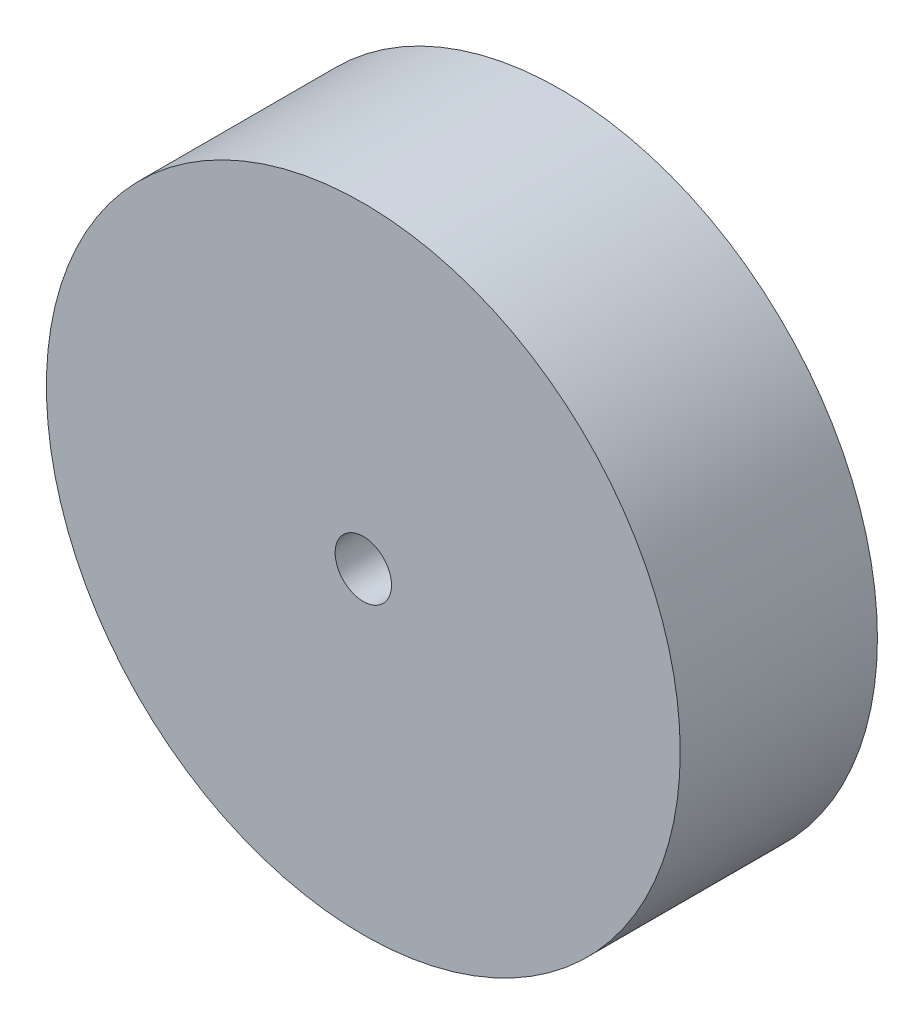
from build123d import *

# Parameters (mm, degrees)
SKETCH1_R           = 2.8575
SKETCH1_R_2         = 0.254
BOSS_EXTRUDE1_DEPTH = 1.778


with BuildPart() as part:
    # Sketch1 → Boss-Extrude1 (new body)
    with BuildSketch(Plane.XY):
        Circle(SKETCH1_R)
        Circle(SKETCH1_R_2, mode=Mode.SUBTRACT)
    extrude(amount=BOSS_EXTRUDE1_DEPTH)


solid = part.part
